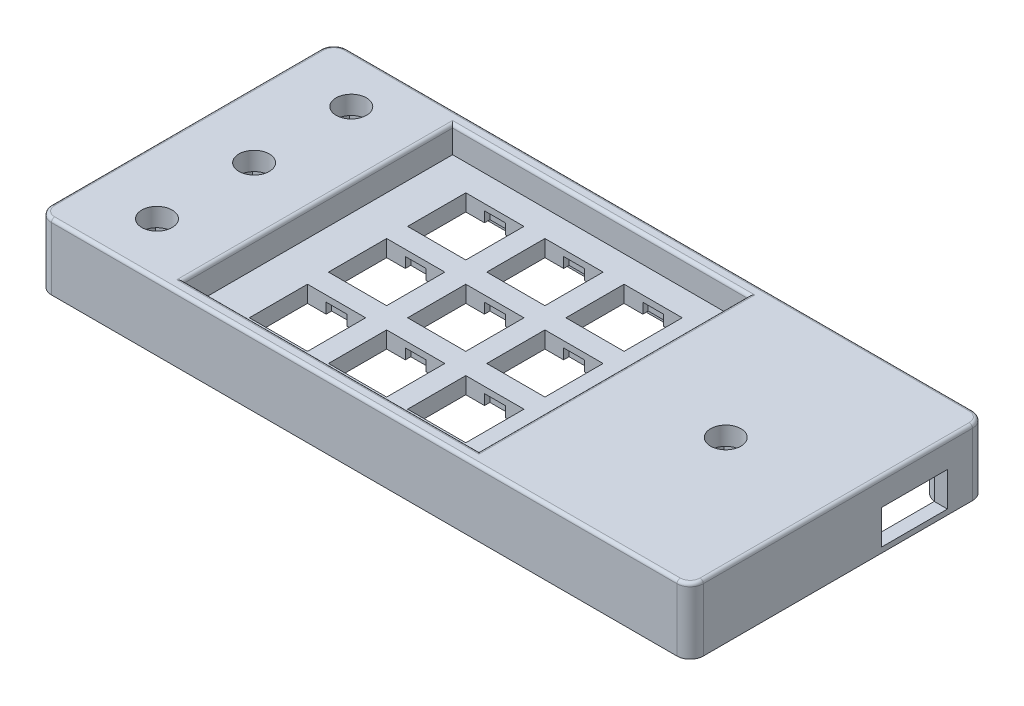
from build123d import *

# Parameters (mm, degrees)
SKETCH1_W            = 71.14794
SKETCH1_H            = 71.14794
BOSS_EXTRUDE1_DEPTH  = 3.999992
SKETCH2_W            = 13.999972
SKETCH2_H            = 13.999972
CUT_EXTRUDE1_DEPTH   = 101.697858311
CUT_EXTRUDE2_START   = -3.999992
SKETCH3_W            = 4.998974
SKETCH3_H            = 1.307084
CUT_EXTRUDE2_DEPTH   = 2.500122
LPATTERN1_COUNT      = 3
LPATTERN1_PITCH      = 19.048984
LPATTERN1_COUNT_DIR2 = 3
LPATTERN1_PITCH_DIR2 = 19.048984
BOSS_EXTRUDE2_START  = -2.350008
SKETCH4_W            = 31.75
SKETCH4_H            = 71.14794
BOSS_EXTRUDE2_DEPTH  = 12.7
SKETCH5_R            = 3.6576
CUT_EXTRUDE3_DEPTH   = 4.445
CUT_EXTRUDE4_START   = -12.7
SKETCH6_W            = 13.97
SKETCH6_H            = 13.208
CUT_EXTRUDE4_DEPTH   = 8.255
SKETCH7_W            = 1.27
SKETCH7_H            = 6.985
CUT_EXTRUDE5_DEPTH   = 3.175
LPATTERN6_COUNT      = 3
LPATTERN6_PITCH      = 23.38197
BOSS_EXTRUDE3_START  = -2.350008
SKETCH9_W            = 53.99605554
SKETCH9_H            = 71.14794
BOSS_EXTRUDE3_DEPTH  = 12.7
SKETCH10_R           = 3.6576
CUT_EXTRUDE6_DEPTH   = 4.445
CUT_EXTRUDE7_START   = -8.255
SKETCH11_W           = 13.97
SKETCH11_H           = 13.208
CUT_EXTRUDE7_DEPTH   = 8.255
SKETCH14_W           = 1.27
SKETCH14_H           = 6.985
CUT_EXTRUDE10_DEPTH  = 3.175
SKETCH15_W           = 71.14794
SKETCH15_H           = 3.175
BOSS_EXTRUDE4_DEPTH  = 6.35
BOSS_EXTRUDE9_START  = -2.350008
SKETCH18_W           = 156.89399554
SKETCH18_H           = 71.14794
SKETCH18_W_2         = 150.54399554
SKETCH18_H_2         = 64.79794
BOSS_EXTRUDE9_DEPTH  = 5.525008
FILLET1_R            = 3.175
FILLET2_R            = 0.79375
SKETCH19_W           = 19.05
SKETCH19_H           = 19.05
CUT_EXTRUDE11_DEPTH  = 2.350008
SKETCH20_W           = 19.05
SKETCH20_H           = 19.05
CUT_EXTRUDE13_DEPTH  = 7.174992
BOSS_EXTRUDE10_REACH = 146.828
SKETCH21_R           = 3.96875
SKETCH22_R           = 2.54
CUT_EXTRUDE14_DEPTH  = 8.001
SKETCH24_W           = 3.175
SKETCH24_H           = 6.35
BOSS_EXTRUDE11_DEPTH = 3.175
SKETCH25_W           = 6.35
SKETCH25_H           = 6.35
BOSS_EXTRUDE12_DEPTH = 3.175
SKETCH27_W           = 3.175
SKETCH27_H           = 5.09397
BOSS_EXTRUDE13_DEPTH = 8.1915
BOSS_EXTRUDE14_START = 1.7145
SKETCH26_W           = 3.175
SKETCH26_H           = 1.5875
BOSS_EXTRUDE14_DEPTH = 1.5875
SKETCH28_W           = 15.875
SKETCH28_H           = 8.255
CUT_EXTRUDE15_DEPTH  = 170.701742155


with BuildPart() as part:
    # Sketch1 → Boss-Extrude1 (new body)
    with BuildSketch(Plane(origin=(0, 0, 0), x_dir=(1, 0, 0), z_dir=(0, 1, 0))):
        with Locations((35.57397, 35.57397)):
            Rectangle(SKETCH1_W, SKETCH1_H)
    extrude(amount=BOSS_EXTRUDE1_DEPTH)

    # Sketch2 → Cut-Extrude1 (cut, through all)
    with BuildSketch(Plane(origin=(0, 3.999992, 0), x_dir=(1, 0, 0), z_dir=(0, 1, 0))):
        with Locations((16.524986, 16.524986)):
            Rectangle(SKETCH2_W, SKETCH2_H)
    cut_extrude1 = extrude(amount=-CUT_EXTRUDE1_DEPTH, mode=Mode.SUBTRACT)

    # Sketch3 → Cut-Extrude2 (cut)
    with BuildSketch(Plane(origin=(0, 3.999992, 0), x_dir=(1, 0, 0), z_dir=(0, 1, 0)).offset(CUT_EXTRUDE2_START)):
        with Locations((16.524986, 24.178514)):
            Rectangle(SKETCH3_W, SKETCH3_H)
        with Locations((16.524986, 8.871458)):
            Rectangle(SKETCH3_W, SKETCH3_H)
    cut_extrude2 = extrude(amount=CUT_EXTRUDE2_DEPTH, mode=Mode.SUBTRACT)

    # LPattern1: Cut-Extrude1, Cut-Extrude2 3 × 3
    with Locations(*[(i * LPATTERN1_PITCH, 0, -j * LPATTERN1_PITCH_DIR2) for i in range(LPATTERN1_COUNT) for j in range(LPATTERN1_COUNT_DIR2) if (i, j) != (0, 0)]):
        add(cut_extrude1, mode=Mode.SUBTRACT)
        add(cut_extrude2, mode=Mode.SUBTRACT)

    # Sketch4 → Boss-Extrude2 (add)
    with BuildSketch(Plane(origin=(0, 0, 0), x_dir=(1, 0, 0), z_dir=(0, 1, 0)).offset(BOSS_EXTRUDE2_START)):
        with Locations((-15.875, 35.57397)):
            Rectangle(SKETCH4_W, SKETCH4_H)
    extrude(amount=BOSS_EXTRUDE2_DEPTH)

    # Sketch5 → Cut-Extrude3 (cut)
    with BuildSketch(Plane(origin=(0, 10.349992, 0), x_dir=(1, 0, 0), z_dir=(0, 1, 0))):
        with Locations(Location((-15.875, 12.7, 0), (0, 0, 270))):
            Circle(SKETCH5_R)
    cut_extrude3 = extrude(amount=-CUT_EXTRUDE3_DEPTH, mode=Mode.SUBTRACT)

    # Sketch6 → Cut-Extrude4 (cut)
    with BuildSketch(Plane(origin=(0, 10.349992, 0), x_dir=(1, 0, 0), z_dir=(0, 1, 0)).offset(CUT_EXTRUDE4_START)):
        with Locations((-15.875, 12.7)):
            Rectangle(SKETCH6_W, SKETCH6_H)
    cut_extrude4 = extrude(amount=CUT_EXTRUDE4_DEPTH, mode=Mode.SUBTRACT)

    # Sketch7 → Cut-Extrude5 (cut)
    with BuildSketch(Plane.XZ.offset(2.350008)):
        with Locations((-23.495, -12.7)):
            Rectangle(SKETCH7_W, SKETCH7_H)
        with Locations((-8.255, -12.7)):
            Rectangle(SKETCH7_W, SKETCH7_H)
    cut_extrude5 = extrude(amount=-CUT_EXTRUDE5_DEPTH, mode=Mode.SUBTRACT)

    # LPattern6: Cut-Extrude3, Cut-Extrude4, Cut-Extrude5 ×3
    with Locations(*[(0, 0, -i * LPATTERN6_PITCH) for i in range(1, LPATTERN6_COUNT)]):
        add(cut_extrude3, mode=Mode.SUBTRACT)
        add(cut_extrude4, mode=Mode.SUBTRACT)
        add(cut_extrude5, mode=Mode.SUBTRACT)

    # Sketch9 → Boss-Extrude3 (add)
    with BuildSketch(Plane(origin=(0, 0, 0), x_dir=(1, 0, 0), z_dir=(0, 1, 0)).offset(BOSS_EXTRUDE3_START)):
        with Locations((98.14596777, 35.57397)):
            Rectangle(SKETCH9_W, SKETCH9_H)
    extrude(amount=BOSS_EXTRUDE3_DEPTH)

    # Sketch10 → Cut-Extrude6 (cut)
    with BuildSketch(Plane(origin=(0, 10.349992, 0), x_dir=(1, 0, 0), z_dir=(0, 1, 0))):
        with Locations(Location((98.14596777, 35.57397, 0), (0, 0, 270))):
            Circle(SKETCH10_R)
    extrude(amount=-CUT_EXTRUDE6_DEPTH, mode=Mode.SUBTRACT)

    # Sketch11 → Cut-Extrude7 (cut)
    with BuildSketch(Plane(origin=(0, 5.904992, 0), x_dir=(1, 0, 0), z_dir=(0, 1, 0)).offset(CUT_EXTRUDE7_START)):
        with Locations((98.14596777, 35.57397)):
            Rectangle(SKETCH11_W, SKETCH11_H)
    extrude(amount=CUT_EXTRUDE7_DEPTH, mode=Mode.SUBTRACT)

    # Sketch14 → Cut-Extrude10 (cut)
    with BuildSketch(Plane.XZ.offset(2.350008)):
        with Locations((90.52596777, -35.57397)):
            Rectangle(SKETCH14_W, SKETCH14_H)
        with Locations((105.76596777, -35.57397)):
            Rectangle(SKETCH14_W, SKETCH14_H)
    extrude(amount=-CUT_EXTRUDE10_DEPTH, mode=Mode.SUBTRACT)

    # Sketch15 → Boss-Extrude4 (add)
    with BuildSketch(Plane(origin=(0, 3.999992, 0), x_dir=(1, 0, 0), z_dir=(0, 1, 0))):
        with Locations((35.57397, 69.56044)):
            Rectangle(SKETCH15_W, SKETCH15_H)
        with Locations((35.57397, 1.5875)):
            Rectangle(SKETCH15_W, SKETCH15_H)
    extrude(amount=BOSS_EXTRUDE4_DEPTH)

    # Sketch18 → Boss-Extrude9 (add)
    with BuildSketch(Plane.XZ.offset(2.350008).offset(BOSS_EXTRUDE9_START)):
        with Locations((46.69699777, -35.57397)):
            Rectangle(SKETCH18_W, SKETCH18_H)
        with Locations((46.69699777, -35.57397)):
            Rectangle(SKETCH18_W_2, SKETCH18_H_2, mode=Mode.SUBTRACT)
    extrude(amount=BOSS_EXTRUDE9_DEPTH)

    # Fillet1
    fillet1_edges = [part.edges().sort_by_distance(p)[0] for p in [
        (-31.75, 2.412492, -71.14794),
        (-31.75, 2.412492, 0),
        (125.14399554, 2.412492, 0),
        (125.14399554, 2.412492, -71.14794),
        (-28.575, -3.937508, -3.175),
        (121.96899554, -3.937508, -3.175),
        (-28.575, -3.937508, -67.97294),
        (121.96899554, -3.937508, -67.97294),
    ]]
    fillet(fillet1_edges, radius=FILLET1_R)

    # Fillet2
    fillet2_edges = [part.edges().sort_by_distance(p)[0] for p in [
        (71.14794, 10.349992, -35.57397),
        (35.57397, 10.349992, -67.97294),
        (0, 10.349992, -35.57397),
        (35.57397, 10.349992, -3.175),
        (-31.75, 10.349992, -35.57397),
        (46.69699777, 10.349992, -71.14794),
        (46.69699777, 10.349992, 0),
        (125.14399554, 10.349992, -35.57397),
        (-30.82006403, 10.349992, -0.92993597),
        (124.21405957, 10.349992, -0.92993597),
        (124.21405957, 10.349992, -70.21800403),
        (-30.82006403, 10.349992, -70.21800403),
    ]]
    fillet(fillet2_edges, radius=FILLET2_R)

    # Sketch19 → Cut-Extrude11 (cut)
    with BuildSketch(Plane.XZ.offset(2.350008)):
        with BuildLine():
            Line((71.14794, -67.97294), (118.79399554, -67.97294))
            ThreePointArc((118.79399554, -67.97294), (121.03905957, -67.04300403), (121.96899554, -64.79794))
            Line((121.96899554, -64.79794), (121.96899554, -6.35))
            ThreePointArc((121.96899554, -6.35), (121.03905957, -4.10493597), (118.79399554, -3.175))
            Line((118.79399554, -3.175), (71.14794, -3.175))
            Line((71.14794, -3.175), (71.14794, -67.97294))
        make_face()
        with Locations((98.14596777, -35.57397)):
            Rectangle(SKETCH19_W, SKETCH19_H, mode=Mode.SUBTRACT)
    extrude(amount=-CUT_EXTRUDE11_DEPTH, mode=Mode.SUBTRACT)

    # Sketch20 → Cut-Extrude13 (cut)
    with BuildSketch(Plane.XZ):
        with BuildLine():
            Line((72.73544, -67.97294), (118.79399554, -67.97294))
            ThreePointArc((118.79399554, -67.97294), (121.03905957, -67.04300403), (121.96899554, -64.79794))
            Line((121.96899554, -64.79794), (121.96899554, -6.35))
            ThreePointArc((121.96899554, -6.35), (121.03905957, -4.10493597), (118.79399554, -3.175))
            Line((118.79399554, -3.175), (72.73544, -3.175))
            Line((72.73544, -3.175), (72.73544, -67.97294))
        make_face()
        with Locations((98.14596777, -35.57397)):
            Rectangle(SKETCH20_W, SKETCH20_H, mode=Mode.SUBTRACT)
    extrude(amount=-CUT_EXTRUDE13_DEPTH, mode=Mode.SUBTRACT)

    # Sketch21 → Boss-Extrude10 (add, up to next)
    with BuildSketch(Plane.XZ.offset(5.525008), mode=Mode.PRIVATE) as boss_extrude10_sk1:
        with Locations((-27.78125, -3.96875)):
            Circle(SKETCH21_R)
    boss_extrude10_tool1 = extrude(boss_extrude10_sk1.sketch, amount=-BOSS_EXTRUDE10_REACH, mode=Mode.PRIVATE) - part.part
    # Sketch21 → Boss-Extrude10 (add, up to next)
    with BuildSketch(Plane.XZ.offset(5.525008), mode=Mode.PRIVATE) as boss_extrude10_sk2:
        with Locations((-27.78125, -67.17919)):
            Circle(SKETCH21_R)
    boss_extrude10_tool2 = extrude(boss_extrude10_sk2.sketch, amount=-BOSS_EXTRUDE10_REACH, mode=Mode.PRIVATE) - part.part
    # Sketch21 → Boss-Extrude10 (add, up to next)
    with BuildSketch(Plane.XZ.offset(5.525008), mode=Mode.PRIVATE) as boss_extrude10_sk3:
        with Locations((121.17524554, -67.17919)):
            Circle(SKETCH21_R)
    boss_extrude10_tool3 = extrude(boss_extrude10_sk3.sketch, amount=-BOSS_EXTRUDE10_REACH, mode=Mode.PRIVATE) - part.part
    # Sketch21 → Boss-Extrude10 (add, up to next)
    with BuildSketch(Plane.XZ.offset(5.525008), mode=Mode.PRIVATE) as boss_extrude10_sk4:
        with Locations((121.17524554, -3.96875)):
            Circle(SKETCH21_R)
    boss_extrude10_tool4 = extrude(boss_extrude10_sk4.sketch, amount=-BOSS_EXTRUDE10_REACH, mode=Mode.PRIVATE) - part.part
    # Sketch21 → Boss-Extrude10 (add, up to next)
    with BuildSketch(Plane.XZ.offset(5.525008), mode=Mode.PRIVATE) as boss_extrude10_sk5:
        with Locations((0, -3.96875)):
            Circle(SKETCH21_R)
    boss_extrude10_tool5 = extrude(boss_extrude10_sk5.sketch, amount=-BOSS_EXTRUDE10_REACH, mode=Mode.PRIVATE) - part.part
    # Sketch21 → Boss-Extrude10 (add, up to next)
    with BuildSketch(Plane.XZ.offset(5.525008), mode=Mode.PRIVATE) as boss_extrude10_sk6:
        with Locations((72.73544, -67.17919)):
            Circle(SKETCH21_R)
    boss_extrude10_tool6 = extrude(boss_extrude10_sk6.sketch, amount=-BOSS_EXTRUDE10_REACH, mode=Mode.PRIVATE) - part.part
    add(boss_extrude10_tool1.solids().sort_by_distance((-27.78125, -5.525008, -3.96875))[0])
    add(boss_extrude10_tool2.solids().sort_by_distance((-27.78125, -5.525008, -67.17919))[0])
    add(boss_extrude10_tool3.solids().sort_by_distance((121.175246, -5.525008, -67.17919))[0])
    add(boss_extrude10_tool4.solids().sort_by_distance((121.175246, -5.525008, -3.96875))[0])
    add(boss_extrude10_tool5.solids().sort_by_distance((0, -5.525008, -3.96875))[0])
    add(boss_extrude10_tool6.solids().sort_by_distance((72.73544, -5.525008, -67.17919))[0])

    # Sketch22 → Cut-Extrude14 (cut)
    with BuildSketch(Plane.XZ.offset(5.525008)):
        with Locations(Location((-27.78125, -3.96875, 0), (0, 0, 270))):
            Circle(SKETCH22_R)
        with Locations(Location((0, -3.96875, 0), (0, 0, 270))):
            Circle(SKETCH22_R)
        with Locations(Location((72.73544, -67.17919, 0), (0, 0, 270))):
            Circle(SKETCH22_R)
        with Locations(Location((-27.78125, -67.17919, 0), (0, 0, 270))):
            Circle(SKETCH22_R)
        with Locations(Location((121.17524554, -67.17919, 0), (0, 0, 270))):
            Circle(SKETCH22_R)
        with Locations(Location((121.17524554, -3.96875, 0), (0, 0, 270))):
            Circle(SKETCH22_R)
    extrude(amount=-CUT_EXTRUDE14_DEPTH, mode=Mode.SUBTRACT)

    # Sketch24 → Boss-Extrude11 (add)
    with BuildSketch(Plane.XZ.offset(-7.174992)):
        with Locations((120.38149554, -53.98897)):
            Rectangle(SKETCH24_W, SKETCH24_H)
    extrude(amount=BOSS_EXTRUDE11_DEPTH)

    # Sketch25 → Boss-Extrude12 (add)
    with BuildSketch(Plane.XZ.offset(-7.174992)):
        with Locations((91.80649554, -53.98897)):
            Rectangle(SKETCH25_W, SKETCH25_H)
    extrude(amount=BOSS_EXTRUDE12_DEPTH)

    # Sketch27 → Boss-Extrude13 (add)
    with BuildSketch(Plane.XZ.offset(-7.174992)):
        with Locations((106.08346777, -65.425955)):
            Rectangle(SKETCH27_W, SKETCH27_H)
    extrude(amount=BOSS_EXTRUDE13_DEPTH)

    # Sketch26 → Boss-Extrude14 (add)
    with BuildSketch(Plane.XZ.offset(-3.999992).offset(BOSS_EXTRUDE14_START)):
        with Locations((106.08346777, -45.89272)):
            Rectangle(SKETCH26_W, SKETCH26_H)
        with Locations((106.08346777, -62.08522)):
            Rectangle(SKETCH26_W, SKETCH26_H)
    extrude(amount=BOSS_EXTRUDE14_DEPTH)

    # Sketch28 → Cut-Extrude15 (cut, through all)
    with BuildSketch(Plane.ZY.offset(-121.96899554)):
        with Locations((-53.98897, -0.127508)):
            Rectangle(SKETCH28_W, SKETCH28_H)
    extrude(amount=-CUT_EXTRUDE15_DEPTH, mode=Mode.SUBTRACT)


solid = part.part
